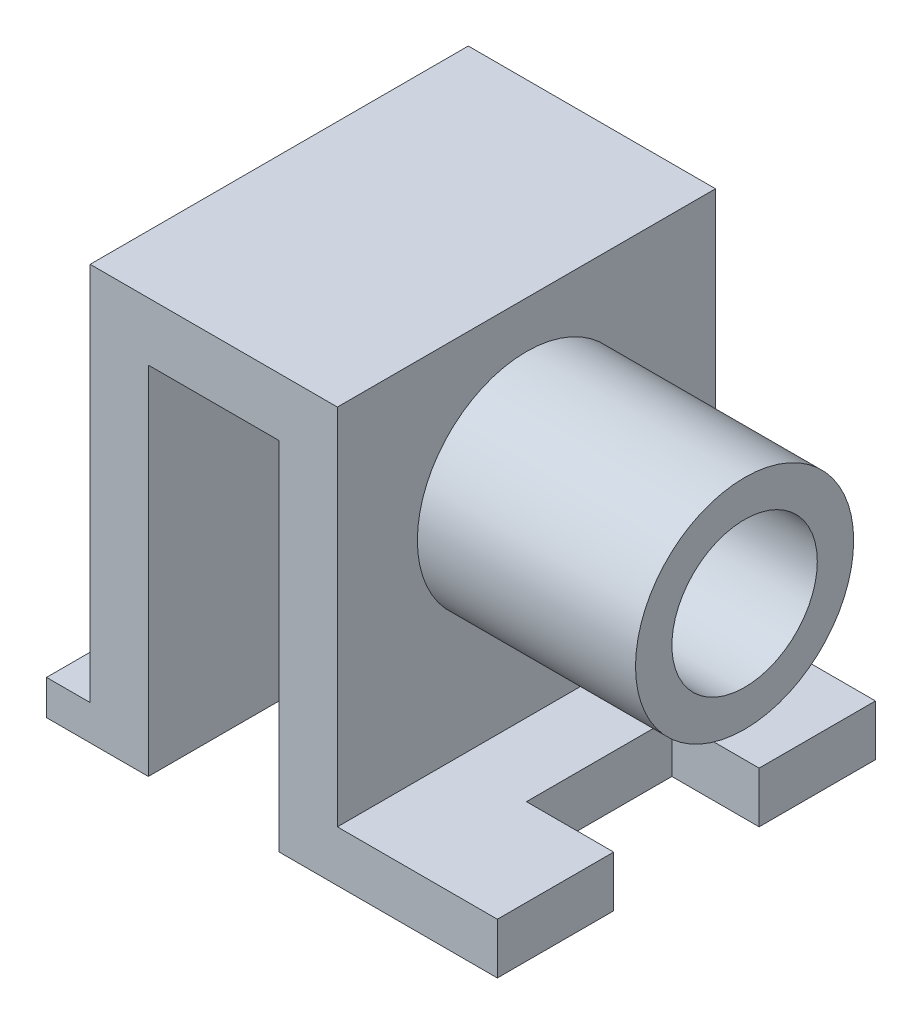
from build123d import *

# Parameters (mm, degrees)
SALIENTE_EXTRUIR2_DEPTH = 26
CORTAR_EXTRUIR1_DEPTH   = 84.785440263
CROQUIS4_R              = 15
CROQUIS4_R_2            = 10
SALIENTE_EXTRUIR3_DEPTH = 30


with BuildPart() as part:
    # Croquis1 → Saliente-Extruir2 (new, symmetric)
    with BuildSketch(Plane.XY):
        Polygon((0, 0), (14, 0), (14, 49), (32, 49), (32, 0), (62, 0), (62, 7), (40, 7), (40, 57), (6, 57), (6, 4.804511278), (0, 4.804511278), align=None)
    extrude(amount=SALIENTE_EXTRUIR2_DEPTH, both=True)

    # Croquis3 → Cortar-Extruir1 (cut, through all)
    with BuildSketch(Plane(origin=(0, 7, 0), x_dir=(1, 0, 0), z_dir=(0, 1, 0))):
        Polygon((62, 0), (62, 10), (50, 10), (50, -10), (62, -10), align=None)
    extrude(amount=-CORTAR_EXTRUIR1_DEPTH, mode=Mode.SUBTRACT)

    # Croquis4 → Saliente-Extruir3 (add)
    with BuildSketch(Plane(origin=(40, 0, 0), x_dir=(0, 0, -1), z_dir=(1, 0, 0))):
        with Locations(Location((0, 35.609925513, 0), (0, 0, 180))):
            Circle(CROQUIS4_R)
        with Locations((0, 35.609925513)):
            Circle(CROQUIS4_R_2, mode=Mode.SUBTRACT)
    extrude(amount=SALIENTE_EXTRUIR3_DEPTH)


solid = part.part
